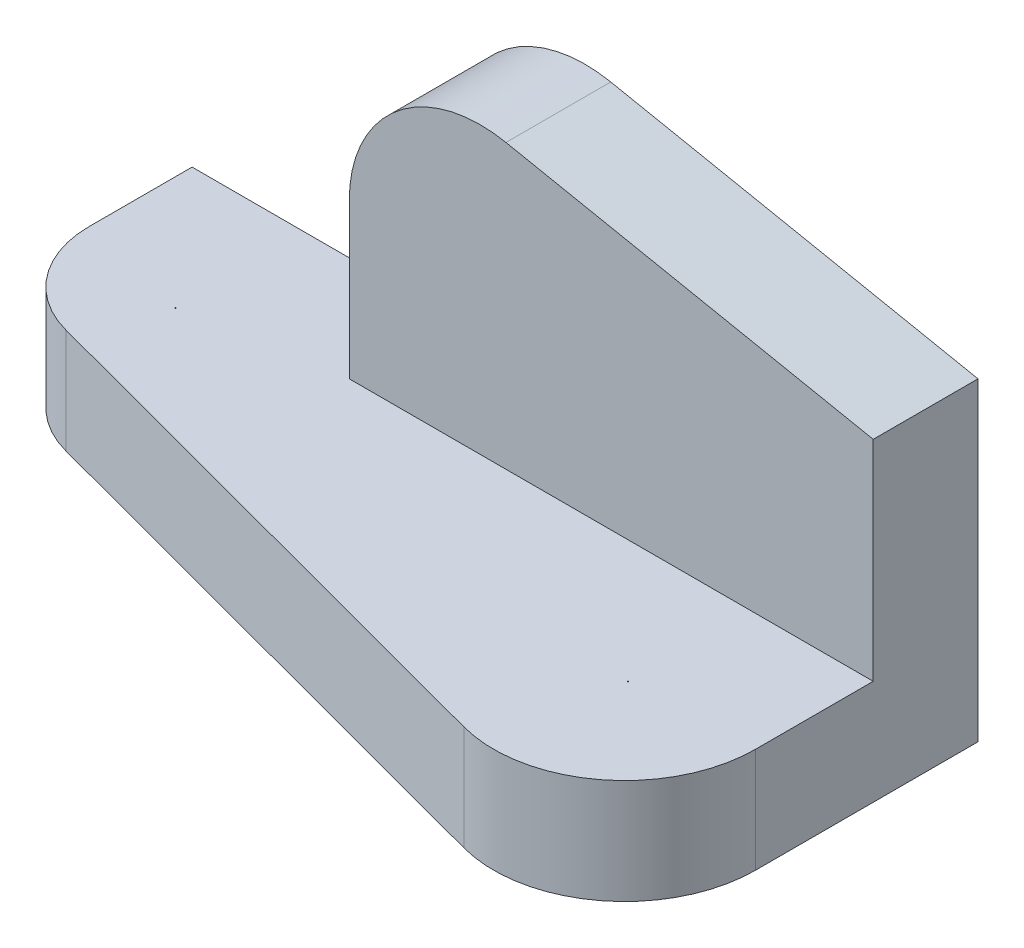
from build123d import *

# Parameters (mm, degrees)
BOSS_EXTRUDE1_DEPTH        = 20
BOSS_EXTRUDE2_DEPTH        = 20
FILLET1_R                  = 20
FILLET2_R                  = 25
F_0_2_0_2_DIAMETER_HOLE1_D = 0.2


with BuildPart() as part:
    # Sketch1 → Boss-Extrude1 (new body)
    with BuildSketch(Plane(origin=(0, 0, 0), x_dir=(1, 0, 0), z_dir=(0, 1, 0))):
        Polygon((0, 0), (0, 35), (150, 35), (150, -40), align=None)
    extrude(amount=BOSS_EXTRUDE1_DEPTH)

    # Sketch3 → Boss-Extrude2 (add)
    with BuildSketch(Plane(origin=(0, 0, -35), x_dir=(-1, 0, 0), z_dir=(0, 0, -1))):
        Polygon((-150, 0), (-150, 60), (-50, 80), (-50, 0), align=None)
    extrude(amount=-BOSS_EXTRUDE2_DEPTH)

    # Fillet1
    fillet1_edges = [part.edges().sort_by_distance(p)[0] for p in [
        (0, 10, 0),
    ]]
    fillet(fillet1_edges, radius=FILLET1_R)

    # Fillet2
    fillet2_edges = [part.edges().sort_by_distance(p)[0] for p in [
        (50, 80, -25),
        (150, 10, 40),
    ]]
    fillet(fillet2_edges, radius=FILLET2_R)

    # Ø0.2 (0.2) Diameter Hole1 (through all)
    with Locations(Plane(origin=(21.699653265, 20, -10.140884984), x_dir=(0, 0, 1), z_dir=(0, 1, 0))):
        with Locations((0, 0), (18.585454109, 104.917886097)):
            Hole(F_0_2_0_2_DIAMETER_HOLE1_D / 2)


solid = part.part
